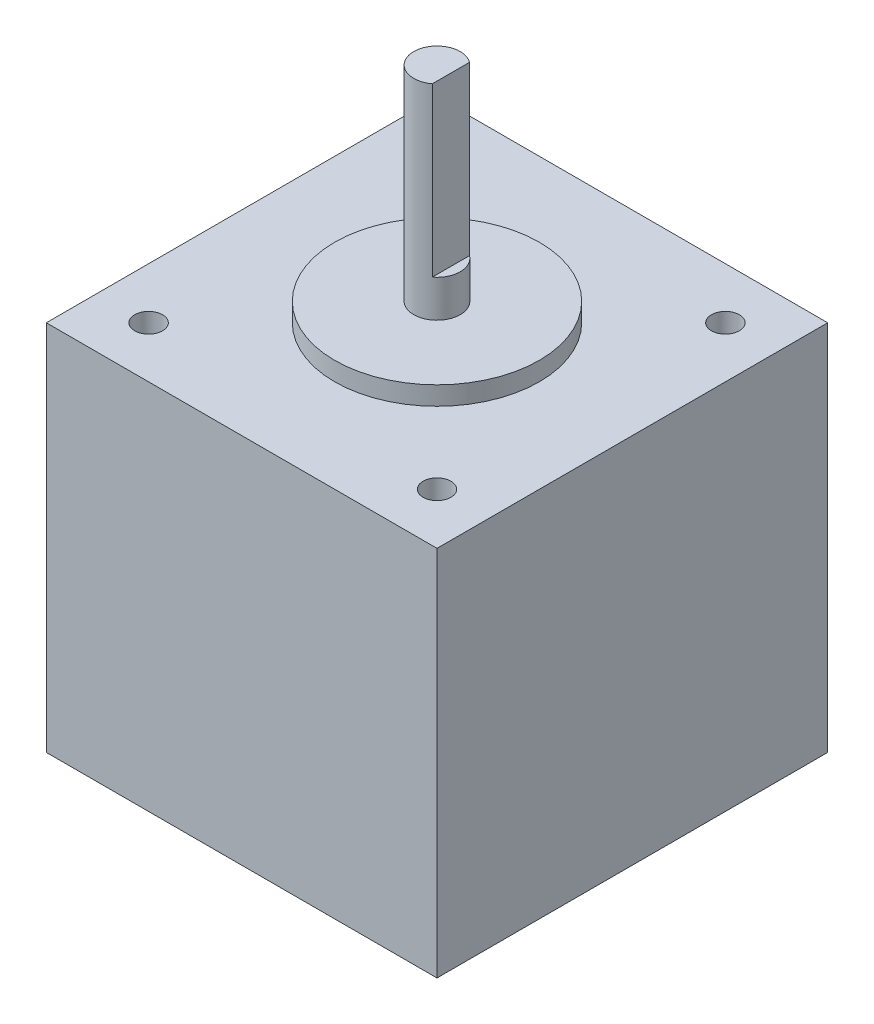
from build123d import *

# Parameters (mm, degrees)
SKETCH_1_W          = 42
SKETCH_1_H          = 42
EXTRUDE_1_DEPTH     = 40
SKETCH_2_R          = 11
EXTRUDE_2_DEPTH     = 2
SKETCH_3_R          = 1.5
CUT_EXTRUDE_1_DEPTH = 40
SKETCH_4_R          = 2.5
EXTRUDE_3_DEPTH     = 22
CUT_EXTRUDE_START   = -18
CUT_EXTRUDE_2_DEPTH = 18


with BuildPart() as part:
    # 草图1 → 凸台-拉伸1 (new body)
    with BuildSketch(Plane(origin=(0, 0, 0), x_dir=(1, 0, 0), z_dir=(0, 1, 0))):
        with Locations((21, 21)):
            Rectangle(SKETCH_1_W, SKETCH_1_H)
    extrude(amount=EXTRUDE_1_DEPTH)

    # 草图2 → 凸台-拉伸2 (add)
    with BuildSketch(Plane(origin=(0, 40, 0), x_dir=(1, 0, 0), z_dir=(0, 1, 0))):
        with Locations(Location((21, 21, 0), (0, 0, 270))):
            Circle(SKETCH_2_R)
    extrude(amount=EXTRUDE_2_DEPTH)

    # 草图3 → 切除-拉伸1 (cut)
    with BuildSketch(Plane.XZ):
        with Locations(Location((5.5, -36.5, 0), (0, 0, 270))):
            Circle(SKETCH_3_R)
        with Locations(Location((36.5, -36.5, 0), (0, 0, 270))):
            Circle(SKETCH_3_R)
        with Locations(Location((36.5, -5.5, 0), (0, 0, 270))):
            Circle(SKETCH_3_R)
        with Locations(Location((5.5, -5.5, 0), (0, 0, 270))):
            Circle(SKETCH_3_R)
    extrude(amount=-CUT_EXTRUDE_1_DEPTH, mode=Mode.SUBTRACT)

    # 草图4 → 凸台-拉伸3 (add)
    with BuildSketch(Plane(origin=(0, 42, 0), x_dir=(1, 0, 0), z_dir=(0, 1, 0))):
        with Locations(Location((21, 21, 0), (0, 0, 270))):
            Circle(SKETCH_4_R)
    extrude(amount=EXTRUDE_3_DEPTH)

    # 草图6 → 切除-拉伸2 (cut)
    with BuildSketch(Plane(origin=(0, 64, 0), x_dir=(1, 0, 0), z_dir=(0, 1, 0)).offset(CUT_EXTRUDE_START)):
        with BuildLine():
            Line((22.5, 23), (22.5, 21))
            Line((22.5, 21), (22.5, 19))
            ThreePointArc((22.5, 19), (23.236067977, 19.881966011), (23.5, 21))
            ThreePointArc((23.5, 21), (23.236067977, 22.118033989), (22.5, 23))
        make_face()
    extrude(amount=CUT_EXTRUDE_2_DEPTH, mode=Mode.SUBTRACT)


solid = part.part
